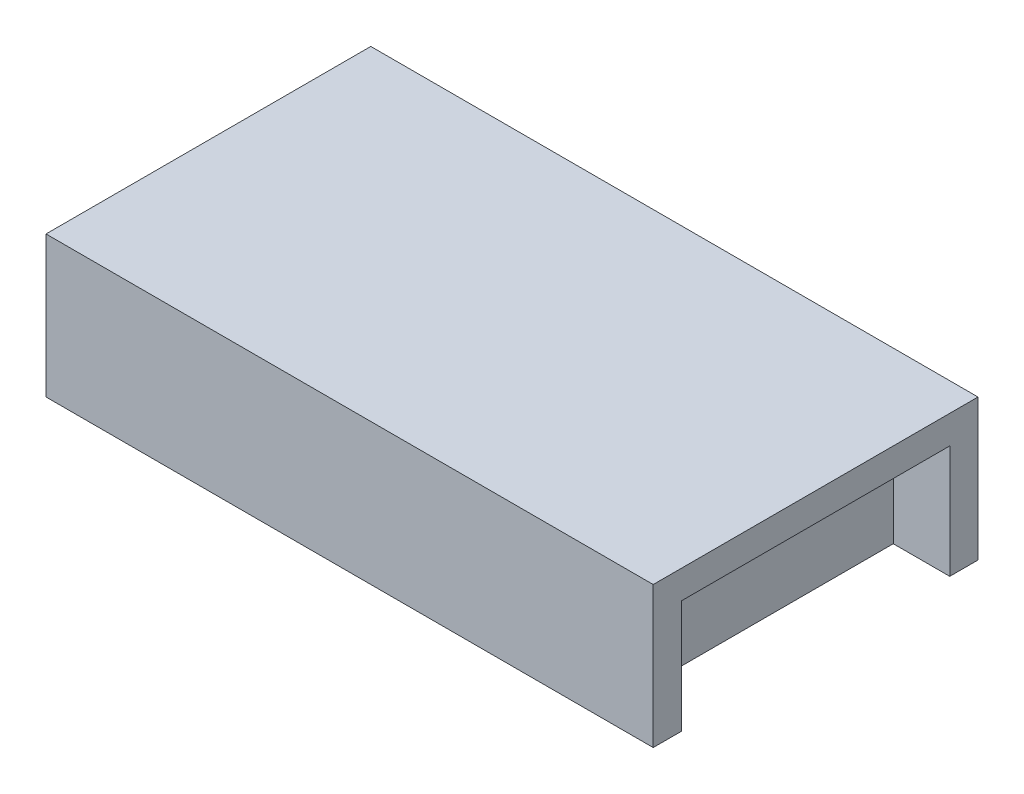
from build123d import *

# Parameters (mm, degrees)
SKETCH_1_W          = 215
SKETCH_1_H          = 115
EXTRUDE_1_DEPTH     = 50
SKETCH_2_W          = 20
SKETCH_2_H          = 95
CUT_EXTRUDE_1_DEPTH = 40


with BuildPart() as part:
    # 草图1 → 凸台-拉伸1 (new body)
    with BuildSketch(Plane(origin=(0, 0, 0), x_dir=(1, 0, 0), z_dir=(0, 1, 0))):
        Rectangle(SKETCH_1_W, SKETCH_1_H)
    extrude(amount=EXTRUDE_1_DEPTH)

    # 草图2 → 切除-拉伸1 (cut)
    with BuildSketch(Plane.XZ):
        with Locations((97.5, 0)):
            Rectangle(SKETCH_2_W, SKETCH_2_H)
    extrude(amount=-CUT_EXTRUDE_1_DEPTH, mode=Mode.SUBTRACT)


solid = part.part
